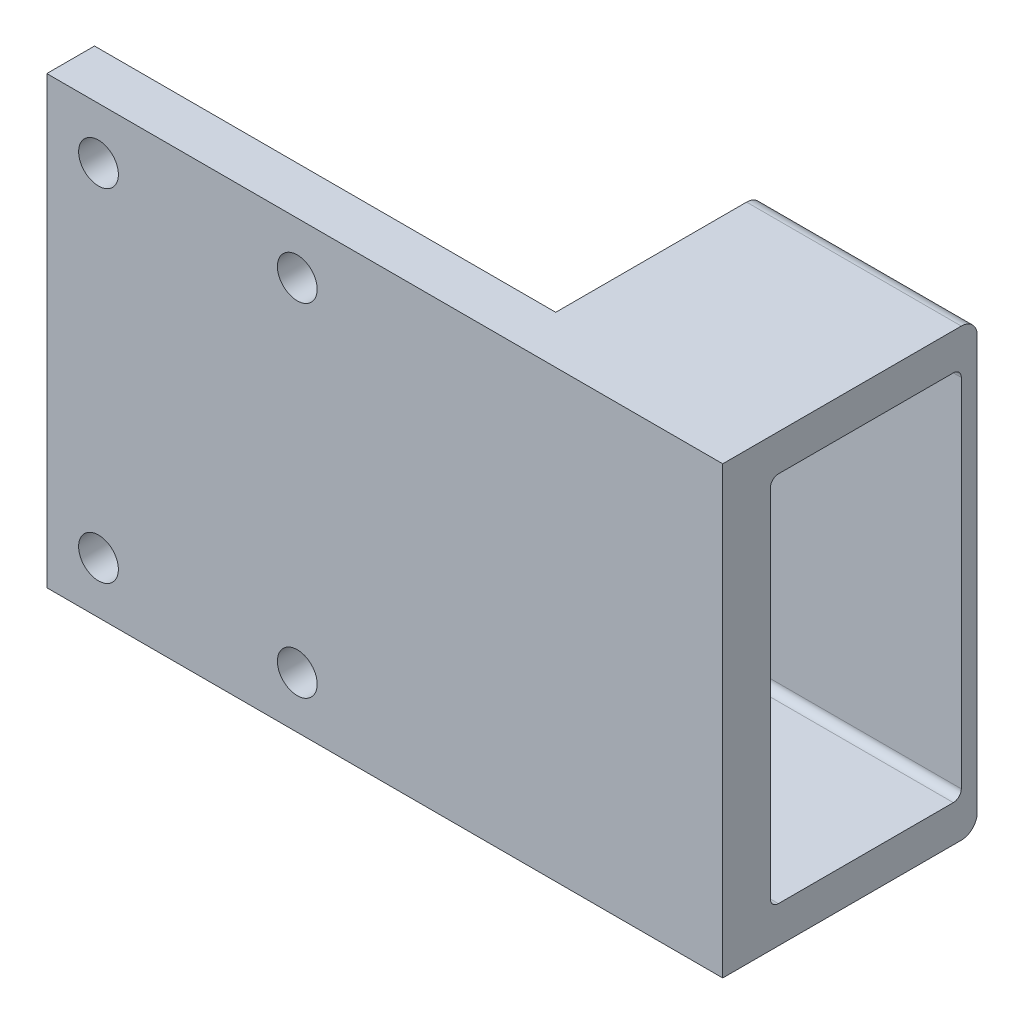
from build123d import *

# Parameters (mm, degrees)
ESQUISSE1_W             = 42.5
ESQUISSE1_H             = 28
BOSS_EXTRU_1_DEPTH      = 3
ESQUISSE2_R             = 1.25
ENL_V_MAT_EXTRU_1_DEPTH = 3
ESQUISSE3_W             = 13.5
ESQUISSE3_H             = 28
BOSS_EXTRU_2_DEPTH      = 13
ESQUISSE4_W             = 12
ESQUISSE4_H             = 23.4
ENL_V_MAT_EXTRU_2_DEPTH = 43.355637169
CONG_1_R                = 0.5
CONG_2_R                = 1


with BuildPart() as part:
    # Esquisse1 → Boss.-Extru.1 (new body)
    with BuildSketch(Plane.XY):
        with Locations((-21.25, -14)):
            Rectangle(ESQUISSE1_W, ESQUISSE1_H)
    extrude(amount=BOSS_EXTRU_1_DEPTH)

    # Esquisse2 → Enlèv. mat.-Extru.1 (cut)
    with BuildSketch(Plane(origin=(0, 0, 0), x_dir=(-1, 0, 0), z_dir=(0, 0, -1))):
        with Locations((39.25, -24.75)):
            Circle(ESQUISSE2_R)
        with Locations((26.75, -24.75)):
            Circle(ESQUISSE2_R)
        with Locations(Location((39.25, -3.25, 0), (0, 0, 180))):
            Circle(ESQUISSE2_R)
        with Locations(Location((26.75, -3.25, 0), (0, 0, 180))):
            Circle(ESQUISSE2_R)
    extrude(amount=-ENL_V_MAT_EXTRU_1_DEPTH, mode=Mode.SUBTRACT)

    # Esquisse3 → Boss.-Extru.2 (add)
    with BuildSketch(Plane(origin=(0, 0, 0), x_dir=(-1, 0, 0), z_dir=(0, 0, -1))):
        with Locations((6.75, -14)):
            Rectangle(ESQUISSE3_W, ESQUISSE3_H)
    extrude(amount=BOSS_EXTRU_2_DEPTH)

    # Esquisse4 → Enlèv. mat.-Extru.2 (cut, through all)
    with BuildSketch(Plane.ZY.offset(13.5)):
        with Locations((-6, -14)):
            Rectangle(ESQUISSE4_W, ESQUISSE4_H)
    extrude(amount=-ENL_V_MAT_EXTRU_2_DEPTH, mode=Mode.SUBTRACT)

    # Congé1
    cong_1_edges = [part.edges().sort_by_distance(p)[0] for p in [
        (-6.75, -25.7, -12),
        (-6.75, -2.3, -12),
        (-6.75, -2.3, 0),
        (-6.75, -25.7, 0),
    ]]
    fillet(cong_1_edges, radius=CONG_1_R)

    # Congé2
    cong_2_edges = [part.edges().sort_by_distance(p)[0] for p in [
        (-6.75, -28, -13),
        (-6.75, 0, -13),
    ]]
    fillet(cong_2_edges, radius=CONG_2_R)


solid = part.part
